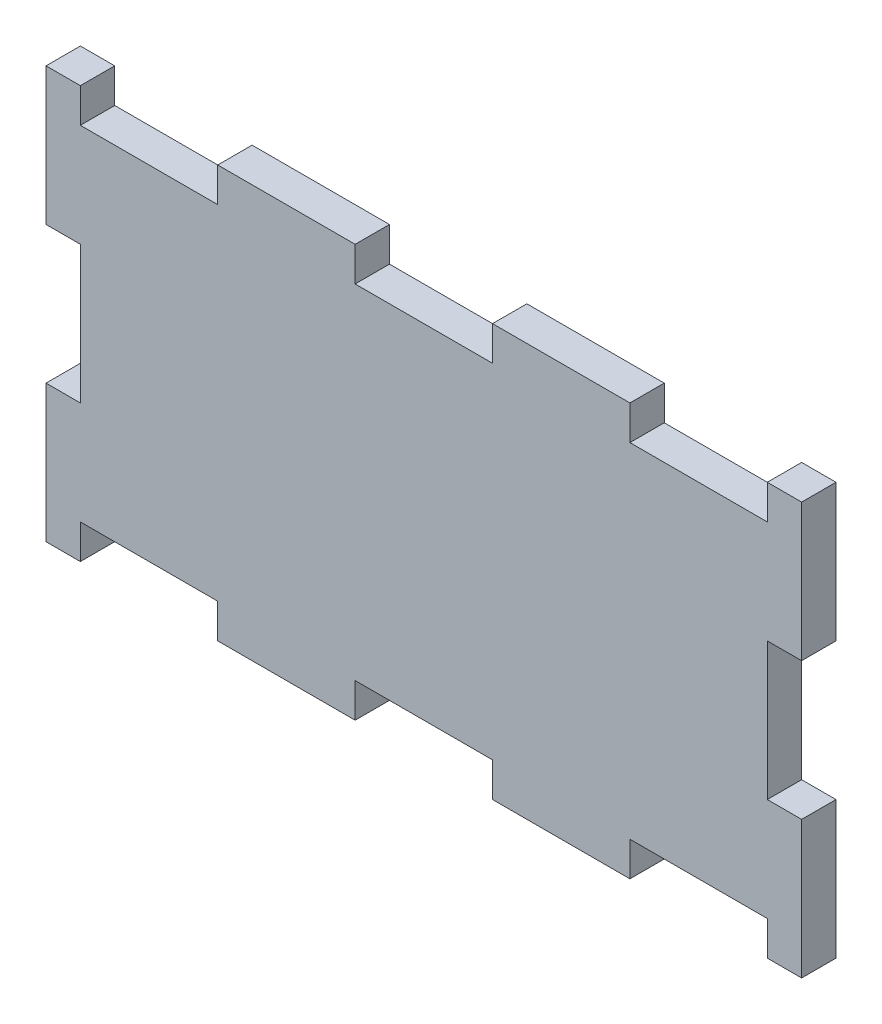
from build123d import *

# Parameters (mm, degrees)
SKETCH_1_W                       = 100
SKETCH_1_H                       = 50
EXTRUDE_1_DEPTH                  = 5
SKETCH_2_W                       = 5
SKETCH_2_H                       = 20
EXTRUDE_2_DEPTH                  = 5
SKETCH_3_W                       = 20
SKETCH_3_H                       = 5
EXTRUDE_3_DEPTH                  = 5
MIRROR_3_COPY_1_SKETCH_W         = 20
MIRROR_3_COPY_1_SKETCH_H         = 5
MIRROR_3_COPY_1_DEPTH            = 5
PATTERN_LINEAR_2_COUNT           = 2
PATTERN_LINEAR_2_PITCH           = 40
PATTERN_LINEAR_2_COPY_1_SKETCH_W = 5
PATTERN_LINEAR_2_COPY_1_SKETCH_H = 20
PATTERN_LINEAR_2_COPY_1_DEPTH    = 5


with BuildPart() as part:
    # 스케치1 → 보스-돌출1 (new body)
    with BuildSketch(Plane.XY):
        Rectangle(SKETCH_1_W, SKETCH_1_H)
    extrude(amount=EXTRUDE_1_DEPTH)

    # 스케치2 → 보스-돌출2 (add)
    with BuildSketch(Plane.XY.offset(5)):
        with Locations((52.5, -20)):
            Rectangle(SKETCH_2_W, SKETCH_2_H)
    extrude_2 = extrude(amount=-EXTRUDE_2_DEPTH)

    # 대칭 복사1: 보스-돌출2 across plane
    add(extrude_2.mirror(Plane(origin=(0, 0, 0), x_dir=(0, 0, 1), z_dir=(1, 0, 0))))

    # 스케치3 → 보스-돌출3 (add)
    with BuildSketch(Plane.XY.offset(5)):
        with Locations((20, 27.5)):
            Rectangle(SKETCH_3_W, SKETCH_3_H)
    extrude_3 = extrude(amount=-EXTRUDE_3_DEPTH)

    # 대칭 복사2: 보스-돌출3 across plane
    add(extrude_3.mirror(Plane(origin=(0, 0, 0), x_dir=(0, 0, 1), z_dir=(1, 0, 0))))

    # 대칭 복사3: 보스-돌출3 across plane
    add(extrude_3.mirror(Plane.ZX))

    # 대칭 복사3 copy 1 sketch → 대칭 복사3 copy 1 (add)
    with BuildSketch(Plane(origin=(0, 0, 5), x_dir=(-1, 0, 0), z_dir=(0, 0, 1))):
        with Locations((20, 27.5)):
            Rectangle(MIRROR_3_COPY_1_SKETCH_W, MIRROR_3_COPY_1_SKETCH_H)
    extrude(amount=-MIRROR_3_COPY_1_DEPTH)

    # 선형 패턴2: 보스-돌출2 ×2
    with Locations(*[(0, i * PATTERN_LINEAR_2_PITCH, 0) for i in range(1, PATTERN_LINEAR_2_COUNT)]):
        add(extrude_2)

    # 선형 패턴2 copy 1 sketch → 선형 패턴2 copy 1 (add)
    with BuildSketch(Plane(origin=(0, 40, 5), x_dir=(-1, 0, 0), z_dir=(0, 0, 1))):
        with Locations((52.5, 20)):
            Rectangle(PATTERN_LINEAR_2_COPY_1_SKETCH_W, PATTERN_LINEAR_2_COPY_1_SKETCH_H)
    extrude(amount=-PATTERN_LINEAR_2_COPY_1_DEPTH)


solid = part.part
